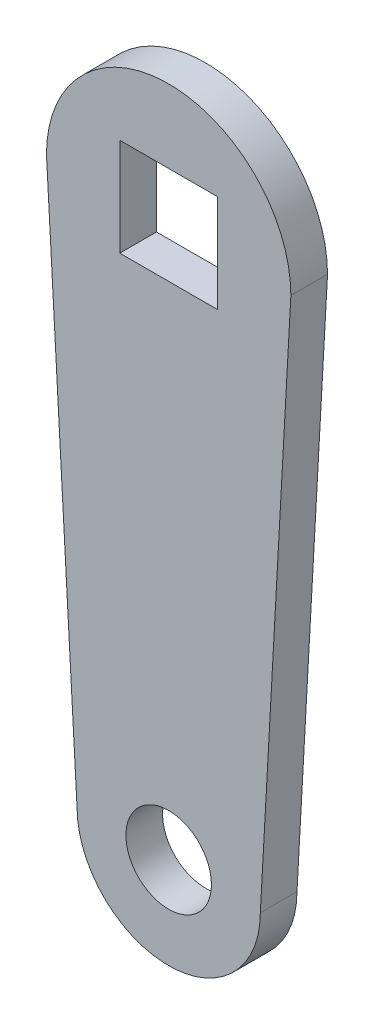
from build123d import *

# Parameters (mm, degrees)
CROQUIS1_R              = 3.5
CROQUIS1_W              = 8
CROQUIS1_H              = 8
SALIENTE_EXTRUIR1_DEPTH = 3


with BuildPart() as part:
    # Croquis1 → Saliente-Extruir1 (new body)
    with BuildSketch(Plane.XY):
        with BuildLine():
            Line((-10, 0), (-7.5, -45))
            ThreePointArc((-7.5, -45), (0, -52.5), (7.5, -45))
            Line((7.5, -45), (10, 0))
            ThreePointArc((10, 0), (0, 10), (-10, 0))
        make_face()
        with Locations((0, -45)):
            Circle(CROQUIS1_R, mode=Mode.SUBTRACT)
        Rectangle(CROQUIS1_W, CROQUIS1_H, mode=Mode.SUBTRACT)
    extrude(amount=SALIENTE_EXTRUIR1_DEPTH)


solid = part.part
